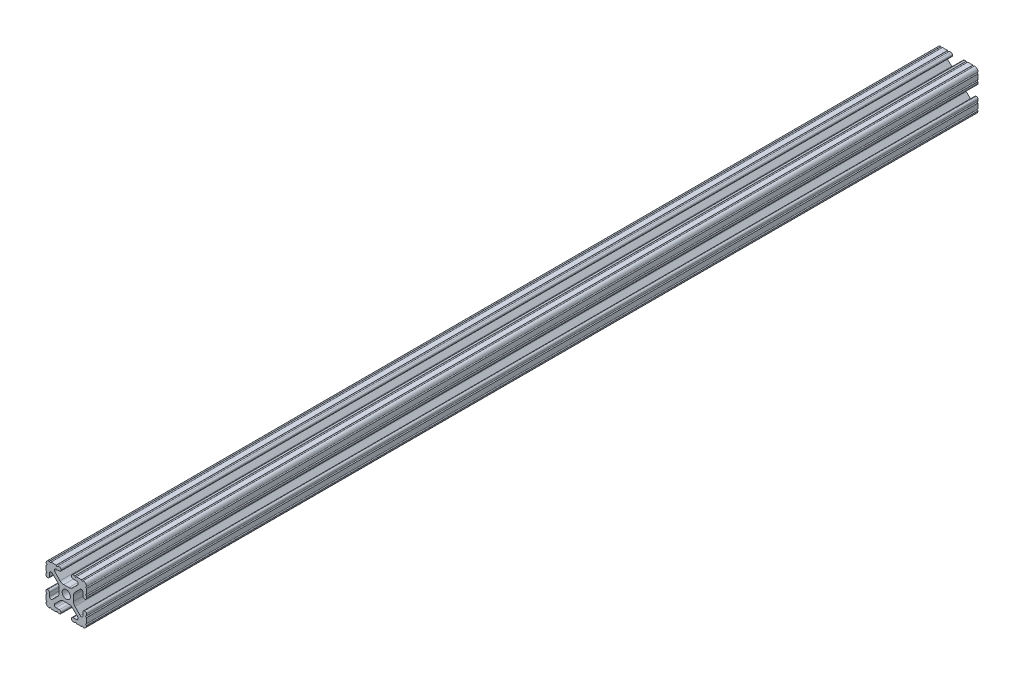
from build123d import *

# Parameters (mm, degrees)
SKETCH1_R      = 2.6035
EXTRUDE1_DEPTH = 558.8


with BuildPart() as part:
    # Sketch1 → Extrude1 (new body)
    with BuildSketch(Plane.XY):
        with BuildLine():
            Line((-7.207036008, 8.724370562), (-3.898272566, 5.423169045))
            ThreePointArc((-3.898272566, 5.423169045), (-2.869120213, 4.736787962), (-1.655778399, 4.4958))
            Line((-1.655778399, 4.4958), (1.655778399, 4.4958))
            ThreePointArc((1.655778399, 4.4958), (2.869120213, 4.736787962), (3.898272566, 5.423169045))
            Line((3.898272566, 5.423169045), (7.207036008, 8.724370562))
            ThreePointArc((7.207036008, 8.724370562), (7.432222385, 9.85140422), (6.476788598, 10.4902))
            Line((6.476788598, 10.4902), (4.287512407, 10.4902))
            ThreePointArc((4.287512407, 10.4902), (3.54574862, 10.79744862), (3.2385, 11.539212407))
            Line((3.2385, 11.539212407), (3.2385, 11.650987593))
            ThreePointArc((3.2385, 11.650987593), (3.54574862, 12.39275138), (4.287512407, 12.7))
            Line((4.287512407, 12.7), (5.317126718, 12.7))
            ThreePointArc((5.317126718, 12.7), (5.825126718, 12.192), (6.333126718, 12.7))
            Line((6.333126718, 12.7), (9.550443118, 12.7))
            ThreePointArc((9.550443118, 12.7), (10.058366869, 12.192000006), (10.566443095, 12.699847501))
            ThreePointArc((10.566443095, 12.699847501), (12.082537762, 12.08250727), (12.699846982, 10.566399977))
            ThreePointArc((12.699846982, 10.566399977), (12.192000006, 10.058323491), (12.7, 9.5504))
            Line((12.7, 9.5504), (12.7, 6.3330836))
            ThreePointArc((12.7, 6.3330836), (12.192, 5.8250836), (12.7, 5.3170836))
            Line((12.7, 5.3170836), (12.7, 4.287469289))
            ThreePointArc((12.7, 4.287469289), (12.39275138, 3.545705502), (11.650987593, 3.238456882))
            Line((11.650987593, 3.238456882), (11.539212407, 3.238456882))
            ThreePointArc((11.539212407, 3.238456882), (10.79744862, 3.545705502), (10.4902, 4.287469289))
            Line((10.4902, 4.287469289), (10.4902, 6.402089023))
            ThreePointArc((10.4902, 6.402089023), (9.856505071, 7.351067942), (8.737131347, 7.129408934))
            Line((8.737131347, 7.129408934), (5.441005833, 3.840816462))
            ThreePointArc((5.441005833, 3.840816462), (4.750877967, 2.809883091), (4.5085, 1.593185507))
            Line((4.5085, 1.593185507), (4.5085, -1.593185507))
            ThreePointArc((4.5085, -1.593185507), (4.750877967, -2.809883091), (5.441005833, -3.840816462))
            Line((5.441005833, -3.840816462), (8.737131347, -7.129408934))
            ThreePointArc((8.737131347, -7.129408934), (9.856505071, -7.351067942), (10.4902, -6.402089023))
            Line((10.4902, -6.402089023), (10.4902, -4.287469289))
            ThreePointArc((10.4902, -4.287469289), (10.79744862, -3.545705502), (11.539212407, -3.238456882))
            Line((11.539212407, -3.238456882), (11.650987593, -3.238456882))
            ThreePointArc((11.650987593, -3.238456882), (12.39275138, -3.545705502), (12.7, -4.287469289))
            Line((12.7, -4.287469289), (12.7, -5.3170836))
            ThreePointArc((12.7, -5.3170836), (12.192, -5.8250836), (12.7, -6.3330836))
            Line((12.7, -6.3330836), (12.7, -9.5504))
            ThreePointArc((12.7, -9.5504), (12.192000006, -10.058323491), (12.699846982, -10.566399977))
            ThreePointArc((12.699846982, -10.566399977), (12.082537762, -12.08250727), (10.566443095, -12.699847501))
            ThreePointArc((10.566443095, -12.699847501), (10.058366869, -12.192000006), (9.550443118, -12.7))
            Line((9.550443118, -12.7), (6.333126718, -12.7))
            ThreePointArc((6.333126718, -12.7), (5.825126718, -12.192), (5.317126718, -12.7))
            Line((5.317126718, -12.7), (4.287512407, -12.7))
            ThreePointArc((4.287512407, -12.7), (3.54574862, -12.39275138), (3.2385, -11.650987593))
            Line((3.2385, -11.650987593), (3.2385, -11.539212407))
            ThreePointArc((3.2385, -11.539212407), (3.54574862, -10.79744862), (4.287512407, -10.4902))
            Line((4.287512407, -10.4902), (6.416408329, -10.4902))
            ThreePointArc((6.416408329, -10.4902), (7.41473083, -9.822813117), (7.179650497, -8.645192506))
            Line((7.179650497, -8.645192506), (3.952270251, -5.423690499))
            ThreePointArc((3.952270251, -5.423690499), (2.922936451, -4.736929036), (1.709253557, -4.4958))
            Line((1.709253557, -4.4958), (-1.709253557, -4.4958))
            ThreePointArc((-1.709253557, -4.4958), (-2.922936451, -4.736929036), (-3.952270251, -5.423690499))
            Line((-3.952270251, -5.423690499), (-7.179650497, -8.645192506))
            ThreePointArc((-7.179650497, -8.645192506), (-7.41473083, -9.822813117), (-6.416408329, -10.4902))
            Line((-6.416408329, -10.4902), (-4.287512407, -10.4902))
            ThreePointArc((-4.287512407, -10.4902), (-3.54574862, -10.79744862), (-3.2385, -11.539212407))
            Line((-3.2385, -11.539212407), (-3.2385, -11.650987593))
            ThreePointArc((-3.2385, -11.650987593), (-3.54574862, -12.39275138), (-4.287512407, -12.7))
            Line((-4.287512407, -12.7), (-5.317126718, -12.7))
            ThreePointArc((-5.317126718, -12.7), (-5.825126718, -12.192), (-6.333126718, -12.7))
            Line((-6.333126718, -12.7), (-9.550443118, -12.7))
            ThreePointArc((-9.550443118, -12.7), (-10.058366869, -12.192000006), (-10.566443095, -12.699847501))
            ThreePointArc((-10.566443095, -12.699847501), (-12.082537762, -12.08250727), (-12.699846982, -10.566399977))
            ThreePointArc((-12.699846982, -10.566399977), (-12.192000006, -10.058323491), (-12.7, -9.5504))
            Line((-12.7, -9.5504), (-12.7, -6.3330836))
            ThreePointArc((-12.7, -6.3330836), (-12.192, -5.8250836), (-12.7, -5.3170836))
            Line((-12.7, -5.3170836), (-12.7, -4.287469289))
            ThreePointArc((-12.7, -4.287469289), (-12.39275138, -3.545705502), (-11.650987593, -3.238456882))
            Line((-11.650987593, -3.238456882), (-11.539212407, -3.238456882))
            ThreePointArc((-11.539212407, -3.238456882), (-10.79744862, -3.545705502), (-10.4902, -4.287469289))
            Line((-10.4902, -4.287469289), (-10.4902, -6.402089023))
            ThreePointArc((-10.4902, -6.402089023), (-9.856505071, -7.351067942), (-8.737131347, -7.129408934))
            Line((-8.737131347, -7.129408934), (-5.441005833, -3.840816462))
            ThreePointArc((-5.441005833, -3.840816462), (-4.750877967, -2.809883091), (-4.5085, -1.593185507))
            Line((-4.5085, -1.593185507), (-4.5085, 1.593185507))
            ThreePointArc((-4.5085, 1.593185507), (-4.750877967, 2.809883091), (-5.441005833, 3.840816462))
            Line((-5.441005833, 3.840816462), (-8.737131347, 7.129408934))
            ThreePointArc((-8.737131347, 7.129408934), (-9.856505071, 7.351067942), (-10.4902, 6.402089023))
            Line((-10.4902, 6.402089023), (-10.4902, 4.287469289))
            ThreePointArc((-10.4902, 4.287469289), (-10.79744862, 3.545705502), (-11.539212407, 3.238456882))
            Line((-11.539212407, 3.238456882), (-11.650987593, 3.238456882))
            ThreePointArc((-11.650987593, 3.238456882), (-12.39275138, 3.545705502), (-12.7, 4.287469289))
            Line((-12.7, 4.287469289), (-12.7, 5.3170836))
            ThreePointArc((-12.7, 5.3170836), (-12.192, 5.8250836), (-12.7, 6.3330836))
            Line((-12.7, 6.3330836), (-12.7, 9.5504))
            ThreePointArc((-12.7, 9.5504), (-12.192000006, 10.058323491), (-12.699846982, 10.566399977))
            ThreePointArc((-12.699846982, 10.566399977), (-12.082537762, 12.08250727), (-10.566443095, 12.699847501))
            ThreePointArc((-10.566443095, 12.699847501), (-10.058366869, 12.192000006), (-9.550443118, 12.7))
            Line((-9.550443118, 12.7), (-6.333126718, 12.7))
            ThreePointArc((-6.333126718, 12.7), (-5.825126718, 12.192), (-5.317126718, 12.7))
            Line((-5.317126718, 12.7), (-4.287512407, 12.7))
            ThreePointArc((-4.287512407, 12.7), (-3.54574862, 12.39275138), (-3.2385, 11.650987593))
            Line((-3.2385, 11.650987593), (-3.2385, 11.539212407))
            ThreePointArc((-3.2385, 11.539212407), (-3.54574862, 10.79744862), (-4.287512407, 10.4902))
            Line((-4.287512407, 10.4902), (-6.476788598, 10.4902))
            ThreePointArc((-6.476788598, 10.4902), (-7.432222385, 9.85140422), (-7.207036008, 8.724370562))
        make_face()
        Circle(SKETCH1_R, mode=Mode.SUBTRACT)
    extrude(amount=-EXTRUDE1_DEPTH)


solid = part.part
